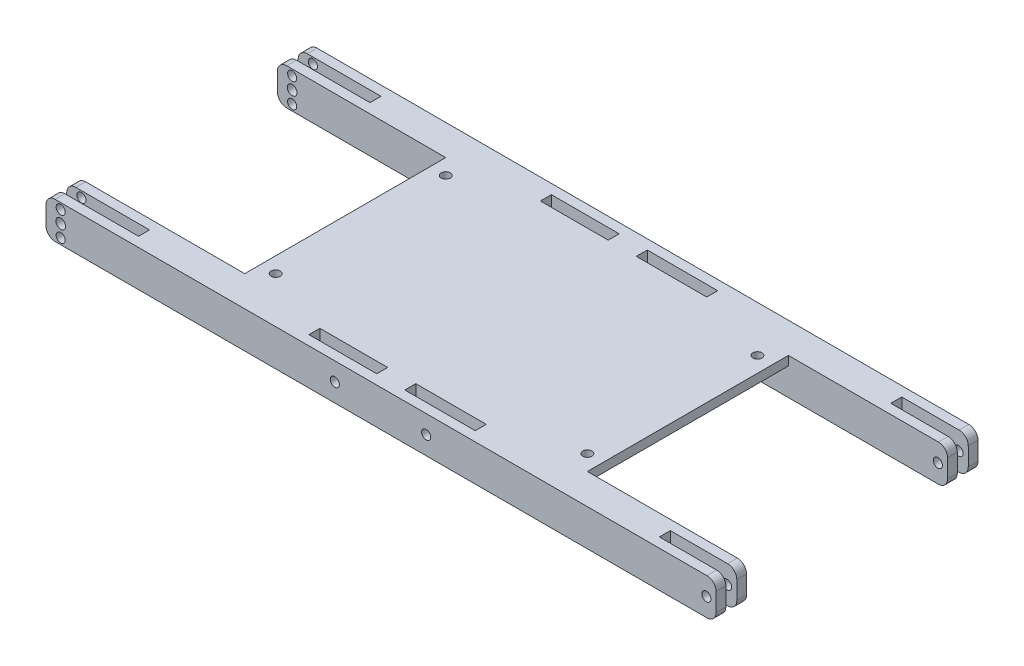
from build123d import *

# Parameters (mm, degrees)
SKETCH1_R           = 1.6
SKETCH1_R_2         = 1.5
BOSS_EXTRUDE3_DEPTH = 3.2
LPATTERN2_COUNT     = 2
LPATTERN2_PITCH     = 6.8
SKETCH9_W           = 9.22
SKETCH9_H           = 12
BOSS_EXTRUDE5_DEPTH = 3.7
SKETCH11_W          = 60.430595346
SKETCH11_H          = 12
BOSS_EXTRUDE6_DEPTH = 3.7
LPATTERN3_COUNT     = 2
LPATTERN3_PITCH     = 76
SKETCH13_W          = 112.501798465
SKETCH13_H          = 66
BOSS_EXTRUDE8_DEPTH = 3
SKETCH14_R          = 1.5
CUT_EXTRUDE2_DEPTH  = 4.318
SKETCH22_W          = 5.174861703
SKETCH22_H          = 10.217447179
BOSS_EXTRUDE9_DEPTH = 4.318


with BuildPart() as part:
    # Sketch1 → Boss-Extrude3 (new body)
    with BuildSketch(Plane.XY):
        with BuildLine():
            Line((-103.947681543, 43.894483621), (110.052318457, 43.894483621))
            ThreePointArc((110.052318457, 43.894483621), (112.1736388, 43.015803964), (113.052318457, 40.894483621))
            Line((113.052318457, 40.894483621), (113.052318457, 34.894483621))
            ThreePointArc((113.052318457, 34.894483621), (112.1736388, 32.773163277), (110.052318457, 31.894483621))
            Line((110.052318457, 31.894483621), (-103.947681543, 31.894483621))
            ThreePointArc((-103.947681543, 31.894483621), (-106.069001887, 32.773163277), (-106.947681543, 34.894483621))
            Line((-106.947681543, 34.894483621), (-106.947681543, 40.894483621))
            ThreePointArc((-106.947681543, 40.894483621), (-106.069001887, 43.015803964), (-103.947681543, 43.894483621))
        make_face()
        with Locations((-102.125890736, 37.895486936)):
            Circle(SKETCH1_R, mode=Mode.SUBTRACT)
        with Locations((-102.125890736, 41.895486936)):
            Circle(SKETCH1_R_2, mode=Mode.SUBTRACT)
        with Locations((-102.125890736, 33.895486936)):
            Circle(SKETCH1_R_2, mode=Mode.SUBTRACT)
        with Locations((109.874217574, 37.891839711)):
            Circle(SKETCH1_R_2, mode=Mode.SUBTRACT)
        with Locations((-12.125890736, 37.895486936)):
            Circle(SKETCH1_R_2, mode=Mode.SUBTRACT)
        with Locations((17.874109264, 37.895486936)):
            Circle(SKETCH1_R_2, mode=Mode.SUBTRACT)
    extrude(amount=BOSS_EXTRUDE3_DEPTH)


with BuildPart() as lpattern2_1:
    # LPattern2: pattern copy
    add(part.part.moved(Location(Vector(0, 0, 1) * (1 * LPATTERN2_PITCH))))


with BuildPart() as part_1:
    add(part.part)

    add(lpattern2_1.part)  # Boss-Extrude5 merges LPattern2_1
    # Sketch9 → Boss-Extrude5 (add)
    with BuildSketch(Plane.XY.offset(3.2)):
        with Locations((3.052318457, 37.894483621)):
            Rectangle(SKETCH9_W, SKETCH9_H)
    extrude(amount=BOSS_EXTRUDE5_DEPTH)

    # Sketch11 → Boss-Extrude6 (add)
    with BuildSketch(Plane.XY.offset(3.2)):
        with Locations((61.010147688, 37.894483621)):
            Rectangle(SKETCH11_W, SKETCH11_H)
        Polygon((-79.696539418, 43.894483621), (-79.758832443, 43.894483621), (-79.758832443, 31.894483621), (-23.819696729, 31.894483621), (-23.819696729, 43.894483621), align=None)
    extrude(amount=BOSS_EXTRUDE6_DEPTH)


with BuildPart() as lpattern3_1:
    # LPattern3: pattern copy
    add(part_1.part.moved(Location(Vector(0, 0, 1) * (1 * LPATTERN3_PITCH))))


with BuildPart() as part_2:
    add(part_1.part)

    add(lpattern3_1.part)  # Boss-Extrude8 merges LPattern3_1
    # Sketch13 → Boss-Extrude8 (add)
    with BuildSketch(Plane(origin=(0, 43.894483621, 0), x_dir=(1, 0, 0), z_dir=(0, 1, 0))):
        with Locations((4.548532601, -43)):
            Rectangle(SKETCH13_W, SKETCH13_H)
    extrude(amount=-BOSS_EXTRUDE8_DEPTH)

    # Sketch14 → Cut-Extrude2 (cut)
    with BuildSketch(Plane(origin=(0, 43.894483621, 0), x_dir=(1, 0, 0), z_dir=(0, 1, 0))):
        with Locations(Location((-46.622366631, -15.08, 0), (0, 0, 270))):
            Circle(SKETCH14_R)
        with Locations(Location((55.719431834, -15.08, 0), (0, 0, 270))):
            Circle(SKETCH14_R)
        with Locations(Location((55.719431834, -70.92, 0), (0, 0, 270))):
            Circle(SKETCH14_R)
        with Locations(Location((-46.622366631, -70.92, 0), (0, 0, 270))):
            Circle(SKETCH14_R)
    extrude(amount=-CUT_EXTRUDE2_DEPTH, mode=Mode.SUBTRACT)

    # Sketch22 → Boss-Extrude9 (add)
    with BuildSketch(Plane.XZ.offset(-40.894483621)):
        with Locations((-36.737847825, 70.891276411)):
            Rectangle(SKETCH22_W, SKETCH22_H)
        with Locations((-21.497847826, 70.891276411)):
            Rectangle(SKETCH22_W, SKETCH22_H)
        with Locations((-6.257847826, 70.891276411)):
            Rectangle(SKETCH22_W, SKETCH22_H)
        with Locations((8.982152175, 70.891276411)):
            Rectangle(SKETCH22_W, SKETCH22_H)
        with Locations((24.222152175, 70.891276411)):
            Rectangle(SKETCH22_W, SKETCH22_H)
        with Locations((39.462152175, 70.891276411)):
            Rectangle(SKETCH22_W, SKETCH22_H)
        with Locations((-21.497847826, 15.011276411)):
            Rectangle(SKETCH22_W, SKETCH22_H)
        with Locations((-6.257847826, 15.011276411)):
            Rectangle(SKETCH22_W, SKETCH22_H)
        with Locations((8.982152175, 15.011276411)):
            Rectangle(SKETCH22_W, SKETCH22_H)
        with Locations((24.222152175, 15.011276411)):
            Rectangle(SKETCH22_W, SKETCH22_H)
        with Locations((39.462152175, 15.011276411)):
            Rectangle(SKETCH22_W, SKETCH22_H)
        with Locations((-36.737847825, 15.011276411)):
            Rectangle(SKETCH22_W, SKETCH22_H)
    extrude(amount=BOSS_EXTRUDE9_DEPTH)


solid = part_2.part
